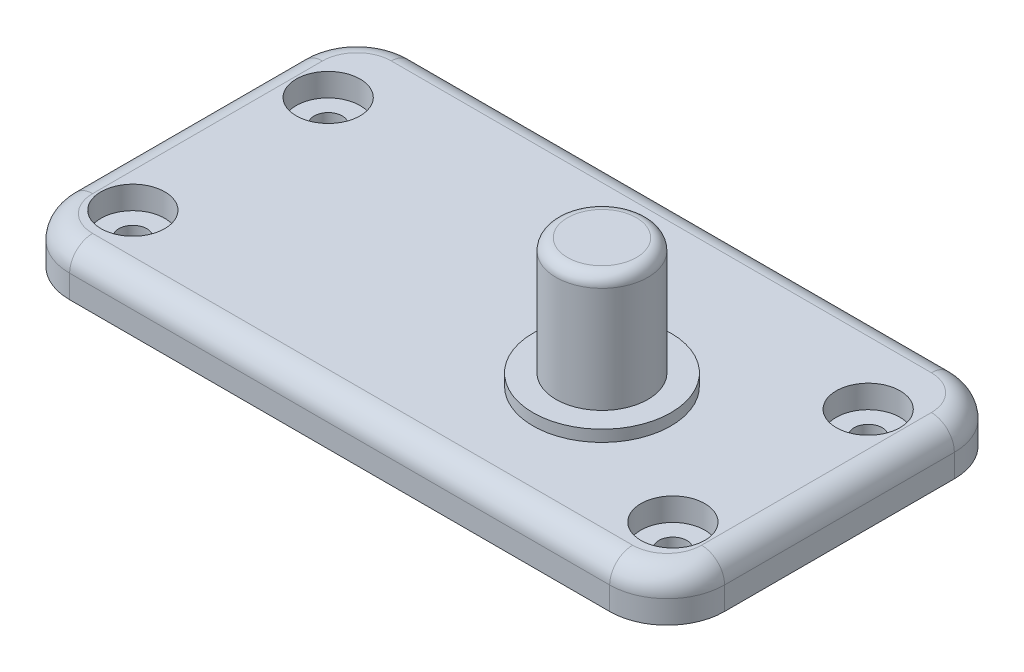
from build123d import *

# Parameters (mm, degrees)
SKETCH1_W                                           = 57
SKETCH1_H                                           = 30
BOSS_EXTRUDE1_DEPTH                                 = 4
SKETCH3_R                                           = 4
BOSS_EXTRUDE2_DEPTH                                 = 11.2
SKETCH4_R                                           = 6
BOSS_EXTRUDE3_DEPTH                                 = 1
CBORE_FOR_2_BINDING_HEAD_MACHINE_SCREW1_D           = 2.4384
CBORE_FOR_2_BINDING_HEAD_MACHINE_SCREW1_CBORE_D     = 5.55752
CBORE_FOR_2_BINDING_HEAD_MACHINE_SCREW1_CBORE_DEPTH = 2.000000064
FILLET1_R                                           = 5
FILLET2_R                                           = 2
FILLET3_R                                           = 1


with BuildPart() as part:
    # Sketch1 → Boss-Extrude1 (new body)
    with BuildSketch(Plane(origin=(0, 0, 0), x_dir=(1, 0, 0), z_dir=(0, 1, 0))):
        Rectangle(SKETCH1_W, SKETCH1_H)
    extrude(amount=BOSS_EXTRUDE1_DEPTH)

    # Sketch3 → Boss-Extrude2 (add)
    with BuildSketch(Plane(origin=(0, 4, 0), x_dir=(1, 0, 0), z_dir=(0, 1, 0))):
        with Locations(Location((10.18, -2.35, 0), (0, 0, 90))):
            Circle(SKETCH3_R)
    extrude(amount=BOSS_EXTRUDE2_DEPTH)

    # Sketch4 → Boss-Extrude3 (add)
    with BuildSketch(Plane(origin=(0, 4, 0), x_dir=(1, 0, 0), z_dir=(0, 1, 0))):
        with Locations(Location((10.18, -2.35, 0), (0, 0, 90))):
            Circle(SKETCH4_R)
    extrude(amount=BOSS_EXTRUDE3_DEPTH)

    # CBORE for #2 Binding Head Machine Screw1 (through all)
    with Locations(Plane(origin=(0, 4, 0), x_dir=(1, 0, 0), z_dir=(0, 1, 0))):
        with Locations((-23.5, 7.5), (-23.5, -9.5), (23.5, -9.5), (23.5, 7.5)):
            CounterBoreHole(CBORE_FOR_2_BINDING_HEAD_MACHINE_SCREW1_D / 2, CBORE_FOR_2_BINDING_HEAD_MACHINE_SCREW1_CBORE_D / 2, CBORE_FOR_2_BINDING_HEAD_MACHINE_SCREW1_CBORE_DEPTH)

    # Fillet1
    fillet1_edges = [part.edges().sort_by_distance(p)[0] for p in [
        (-28.5, 2, -15),
        (28.5, 2, -15),
        (28.5, 2, 15),
        (-28.5, 2, 15),
    ]]
    fillet(fillet1_edges, radius=FILLET1_R)

    # Fillet2
    fillet2_edges = [part.edges().sort_by_distance(p)[0] for p in [
        (0, 4, -15),
        (28.5, 4, 0),
        (-28.5, 4, 0),
        (0, 4, 15),
        (-27.035533906, 4, 13.535533906),
        (-27.035533906, 4, -13.535533906),
        (27.035533906, 4, 13.535533906),
        (27.035533906, 4, -13.535533906),
    ]]
    fillet(fillet2_edges, radius=FILLET2_R)

    # Fillet3
    fillet3_edges = [part.edges().sort_by_distance(p)[0] for p in [
        (10.18, 15.2, 6.35),
    ]]
    fillet(fillet3_edges, radius=FILLET3_R)


solid = part.part
